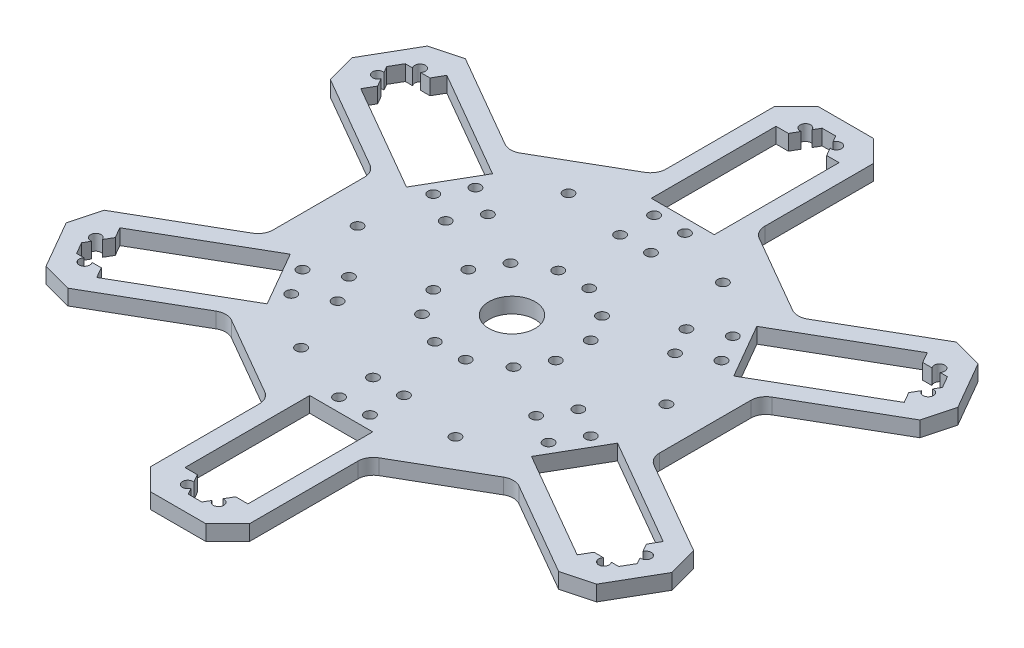
from build123d import *

# Parameters (mm, degrees)
SKETCH_1_R      = 1.7
SKETCH_1_R_2    = 7.5
EXTRUDE_1_DEPTH = 5


with BuildPart() as part:
    # 草图1 → 凸台-拉伸1 (new body)
    with BuildSketch(Plane(origin=(0, 0, 0), x_dir=(1, 0, 0), z_dir=(0, 1, 0))):
        with BuildLine():
            Line((1497.279681371, 1171.189146209), (1471.720080933, 1185.945988402))
            ThreePointArc((1471.720080933, 1185.945988402), (1469.220080933, 1186.615861383), (1466.720080933, 1185.945988402))
            Line((1466.720080933, 1185.945988402), (1436.311115589, 1168.389364075))
            Line((1436.311115589, 1168.389364075), (1426.651857326, 1170.977554526))
            Line((1426.651857326, 1170.977554526), (1417.722925138, 1186.442918733))
            Line((1417.722925138, 1186.442918733), (1420.311115589, 1196.102176996))
            Line((1420.311115589, 1196.102176996), (1450.720080933, 1213.658801323))
            ThreePointArc((1450.720080933, 1213.658801323), (1452.550207951, 1215.488928342), (1453.220080933, 1217.988928342))
            Line((1453.220080933, 1217.988928342), (1453.220080933, 1247.502612729))
            ThreePointArc((1453.220080933, 1247.502612729), (1452.550207951, 1250.002612729), (1450.720080933, 1251.832739748))
            Line((1450.720080933, 1251.832739748), (1420.311115589, 1269.389364075))
            Line((1420.311115589, 1269.389364075), (1417.722925138, 1279.048622338))
            Line((1417.722925138, 1279.048622338), (1426.651857326, 1294.513986545))
            Line((1426.651857326, 1294.513986545), (1436.311115589, 1297.102176996))
            Line((1436.311115589, 1297.102176996), (1466.720080933, 1279.545552669))
            ThreePointArc((1466.720080933, 1279.545552669), (1469.220080933, 1278.875679688), (1471.720080933, 1279.545552669))
            Line((1471.720080933, 1279.545552669), (1497.279681371, 1294.302394863))
            ThreePointArc((1497.279681371, 1294.302394863), (1499.10980839, 1296.132521882), (1499.779681371, 1298.632521882))
            Line((1499.779681371, 1298.632521882), (1499.779681371, 1333.745770536))
            Line((1499.779681371, 1333.745770536), (1506.850749183, 1340.816838348))
            Line((1506.850749183, 1340.816838348), (1524.708613559, 1340.816838348))
            Line((1524.708613559, 1340.816838348), (1531.779681371, 1333.745770536))
            Line((1531.779681371, 1333.745770536), (1531.779681371, 1298.632521882))
            ThreePointArc((1531.779681371, 1298.632521882), (1532.449554352, 1296.132521882), (1534.279681371, 1294.302394863))
            Line((1534.279681371, 1294.302394863), (1559.839281809, 1279.545552669))
            ThreePointArc((1559.839281809, 1279.545552669), (1562.339281809, 1278.875679688), (1564.839281809, 1279.545552669))
            Line((1564.839281809, 1279.545552669), (1595.248247153, 1297.102176996))
            Line((1595.248247153, 1297.102176996), (1604.907505416, 1294.513986545))
            Line((1604.907505416, 1294.513986545), (1613.836437604, 1279.048622338))
            Line((1613.836437604, 1279.048622338), (1611.248247153, 1269.389364075))
            Line((1611.248247153, 1269.389364075), (1580.839281809, 1251.832739748))
            ThreePointArc((1580.839281809, 1251.832739748), (1579.00915479, 1250.002612729), (1578.339281809, 1247.502612729))
            Line((1578.339281809, 1247.502612729), (1578.339281809, 1217.988928342))
            ThreePointArc((1578.339281809, 1217.988928342), (1579.00915479, 1215.488928342), (1580.839281809, 1213.658801323))
            Line((1580.839281809, 1213.658801323), (1611.248247153, 1196.102176996))
            Line((1611.248247153, 1196.102176996), (1613.836437604, 1186.442918733))
            Line((1613.836437604, 1186.442918733), (1604.907505416, 1170.977554526))
            Line((1604.907505416, 1170.977554526), (1595.248247153, 1168.389364075))
            Line((1595.248247153, 1168.389364075), (1564.839281809, 1185.945988402))
            ThreePointArc((1564.839281809, 1185.945988402), (1562.339281809, 1186.615861383), (1559.839281809, 1185.945988402))
            Line((1559.839281809, 1185.945988402), (1534.279681371, 1171.189146209))
            ThreePointArc((1534.279681371, 1171.189146209), (1532.449554352, 1169.35901919), (1531.779681371, 1166.85901919))
            Line((1531.779681371, 1166.85901919), (1531.779681371, 1131.745770536))
            Line((1531.779681371, 1131.745770536), (1524.708613559, 1124.674702724))
            Line((1524.708613559, 1124.674702724), (1506.850749183, 1124.674702724))
            Line((1506.850749183, 1124.674702724), (1499.779681371, 1131.745770536))
            Line((1499.779681371, 1131.745770536), (1499.779681371, 1166.85901919))
            ThreePointArc((1499.779681371, 1166.85901919), (1499.10980839, 1169.35901919), (1497.279681371, 1171.189146209))
        make_face()
        with Locations(Location((1474.112385778, 1262.575897555, 0), (0, 0, 270))):
            Circle(SKETCH_1_R, mode=Mode.SUBTRACT)
        with Locations(Location((1469.112385778, 1253.915643517, 0), (0, 0, 270))):
            Circle(SKETCH_1_R, mode=Mode.SUBTRACT)
        with Locations(Location((1483.63866522, 1257.075897555, 0), (0, 0, 270))):
            Circle(SKETCH_1_R, mode=Mode.SUBTRACT)
        with Locations(Location((1478.63866522, 1248.415643517, 0), (0, 0, 270))):
            Circle(SKETCH_1_R, mode=Mode.SUBTRACT)
        with Locations(Location((1500.959173295, 1247.075897555, 0), (0, 0, 270))):
            Circle(SKETCH_1_R, mode=Mode.SUBTRACT)
        with Locations(Location((1495.959173295, 1238.415643517, 0), (0, 0, 270))):
            Circle(SKETCH_1_R, mode=Mode.SUBTRACT)
        with Locations(Location((1465.779681371, 1232.745770536, 0), (0, 0, 270))):
            Circle(SKETCH_1_R, mode=Mode.SUBTRACT)
        with Locations(Location((1469.112385778, 1211.575897555, 0), (0, 0, 270))):
            Circle(SKETCH_1_R, mode=Mode.SUBTRACT)
        with Locations(Location((1474.112385778, 1202.915643517, 0), (0, 0, 270))):
            Circle(SKETCH_1_R, mode=Mode.SUBTRACT)
        with Locations(Location((1478.63866522, 1217.075897555, 0), (0, 0, 270))):
            Circle(SKETCH_1_R, mode=Mode.SUBTRACT)
        with Locations(Location((1483.63866522, 1208.415643517, 0), (0, 0, 270))):
            Circle(SKETCH_1_R, mode=Mode.SUBTRACT)
        with Locations(Location((1495.959173295, 1227.075897555, 0), (0, 0, 270))):
            Circle(SKETCH_1_R, mode=Mode.SUBTRACT)
        with Locations(Location((1500.959173295, 1218.415643517, 0), (0, 0, 270))):
            Circle(SKETCH_1_R, mode=Mode.SUBTRACT)
        with Locations(Location((1490.779681371, 1189.444500346, 0), (0, 0, 270))):
            Circle(SKETCH_1_R, mode=Mode.SUBTRACT)
        with Locations(Location((1510.779681371, 1181.745770536, 0), (0, 0, 270))):
            Circle(SKETCH_1_R, mode=Mode.SUBTRACT)
        with Locations(Location((1520.779681371, 1181.745770536, 0), (0, 0, 270))):
            Circle(SKETCH_1_R, mode=Mode.SUBTRACT)
        with Locations(Location((1510.779681371, 1192.745770536, 0), (0, 0, 270))):
            Circle(SKETCH_1_R, mode=Mode.SUBTRACT)
        with Locations(Location((1520.779681371, 1192.745770536, 0), (0, 0, 270))):
            Circle(SKETCH_1_R, mode=Mode.SUBTRACT)
        with Locations(Location((1510.779681371, 1212.745770536, 0), (0, 0, 270))):
            Circle(SKETCH_1_R, mode=Mode.SUBTRACT)
        with Locations(Location((1520.779681371, 1212.745770536, 0), (0, 0, 270))):
            Circle(SKETCH_1_R, mode=Mode.SUBTRACT)
        with Locations(Location((1540.779681371, 1189.444500346, 0), (0, 0, 270))):
            Circle(SKETCH_1_R, mode=Mode.SUBTRACT)
        with Locations(Location((1557.446976964, 1202.915643517, 0), (0, 0, 270))):
            Circle(SKETCH_1_R, mode=Mode.SUBTRACT)
        with Locations(Location((1562.446976964, 1211.575897555, 0), (0, 0, 270))):
            Circle(SKETCH_1_R, mode=Mode.SUBTRACT)
        with Locations(Location((1547.920697522, 1208.415643517, 0), (0, 0, 270))):
            Circle(SKETCH_1_R, mode=Mode.SUBTRACT)
        with Locations(Location((1552.920697522, 1217.075897555, 0), (0, 0, 270))):
            Circle(SKETCH_1_R, mode=Mode.SUBTRACT)
        with Locations(Location((1530.600189447, 1218.415643517, 0), (0, 0, 270))):
            Circle(SKETCH_1_R, mode=Mode.SUBTRACT)
        with Locations(Location((1535.600189447, 1227.075897555, 0), (0, 0, 270))):
            Circle(SKETCH_1_R, mode=Mode.SUBTRACT)
        with Locations(Location((1565.779681371, 1232.745770536, 0), (0, 0, 270))):
            Circle(SKETCH_1_R, mode=Mode.SUBTRACT)
        with Locations(Location((1562.446976964, 1253.915643517, 0), (0, 0, 270))):
            Circle(SKETCH_1_R, mode=Mode.SUBTRACT)
        with Locations(Location((1557.446976964, 1262.575897555, 0), (0, 0, 270))):
            Circle(SKETCH_1_R, mode=Mode.SUBTRACT)
        with Locations(Location((1552.920697522, 1248.415643517, 0), (0, 0, 270))):
            Circle(SKETCH_1_R, mode=Mode.SUBTRACT)
        with Locations(Location((1547.920697522, 1257.075897555, 0), (0, 0, 270))):
            Circle(SKETCH_1_R, mode=Mode.SUBTRACT)
        with Locations(Location((1535.600189447, 1238.415643517, 0), (0, 0, 270))):
            Circle(SKETCH_1_R, mode=Mode.SUBTRACT)
        with Locations(Location((1530.600189447, 1247.075897555, 0), (0, 0, 270))):
            Circle(SKETCH_1_R, mode=Mode.SUBTRACT)
        with Locations(Location((1540.779681371, 1276.047040725, 0), (0, 0, 270))):
            Circle(SKETCH_1_R, mode=Mode.SUBTRACT)
        with Locations(Location((1520.779681371, 1283.745770536, 0), (0, 0, 270))):
            Circle(SKETCH_1_R, mode=Mode.SUBTRACT)
        with Locations(Location((1510.779681371, 1283.745770536, 0), (0, 0, 270))):
            Circle(SKETCH_1_R, mode=Mode.SUBTRACT)
        with Locations(Location((1520.779681371, 1272.745770536, 0), (0, 0, 270))):
            Circle(SKETCH_1_R, mode=Mode.SUBTRACT)
        with Locations(Location((1510.779681371, 1272.745770536, 0), (0, 0, 270))):
            Circle(SKETCH_1_R, mode=Mode.SUBTRACT)
        with Locations(Location((1520.779681371, 1252.745770536, 0), (0, 0, 270))):
            Circle(SKETCH_1_R, mode=Mode.SUBTRACT)
        with Locations(Location((1510.779681371, 1252.745770536, 0), (0, 0, 270))):
            Circle(SKETCH_1_R, mode=Mode.SUBTRACT)
        with Locations(Location((1490.779681371, 1276.047040725, 0), (0, 0, 270))):
            Circle(SKETCH_1_R, mode=Mode.SUBTRACT)
        with Locations(Location((1515.779681371, 1232.745770536, 0), (0, 0, 270))):
            Circle(SKETCH_1_R_2, mode=Mode.SUBTRACT)
        with BuildLine():
            Line((1438.001050229, 1289.429229654), (1472.988476542, 1269.229229654))
            Line((1472.988476542, 1269.229229654), (1462.788476542, 1251.562311417))
            Line((1462.788476542, 1251.562311417), (1427.801050229, 1271.762311417))
            Line((1427.801050229, 1271.762311417), (1429.801050229, 1275.226413032))
            Line((1429.801050229, 1275.226413032), (1428.282561049, 1277.856513442))
            ThreePointArc((1428.282561049, 1277.856513442), (1425.204897806, 1277.565643517), (1426.995630172, 1280.085543107))
            Line((1426.995630172, 1280.085543107), (1425.801050229, 1282.154616263))
            Line((1425.801050229, 1282.154616263), (1428.001050229, 1285.965128039))
            Line((1428.001050229, 1285.965128039), (1430.390210115, 1285.965128039))
            ThreePointArc((1430.390210115, 1285.965128039), (1431.677140992, 1288.775897555), (1432.96407187, 1285.965128039))
            Line((1432.96407187, 1285.965128039), (1436.001050229, 1285.965128039))
            Line((1436.001050229, 1285.965128039), (1438.001050229, 1289.429229654))
        make_face(mode=Mode.SUBTRACT)
        with BuildLine():
            Line((1427.801050229, 1193.729229654), (1462.788476542, 1213.929229654))
            Line((1462.788476542, 1213.929229654), (1472.988476542, 1196.262311417))
            Line((1472.988476542, 1196.262311417), (1438.001050229, 1176.062311417))
            Line((1438.001050229, 1176.062311417), (1436.001050229, 1179.526413032))
            Line((1436.001050229, 1179.526413032), (1432.96407187, 1179.526413032))
            ThreePointArc((1432.96407187, 1179.526413032), (1431.677140992, 1176.715643517), (1430.390210115, 1179.526413032))
            Line((1430.390210115, 1179.526413032), (1428.001050229, 1179.526413032))
            Line((1428.001050229, 1179.526413032), (1425.801050229, 1183.336924809))
            Line((1425.801050229, 1183.336924809), (1426.995630172, 1185.405997964))
            ThreePointArc((1426.995630172, 1185.405997964), (1425.204897806, 1187.925897555), (1428.282561049, 1187.63502763))
            Line((1428.282561049, 1187.63502763), (1429.801050229, 1190.265128039))
            Line((1429.801050229, 1190.265128039), (1427.801050229, 1193.729229654))
        make_face(mode=Mode.SUBTRACT)
        with BuildLine():
            Line((1505.579681371, 1137.045770536), (1505.579681371, 1177.445770536))
            Line((1505.579681371, 1177.445770536), (1525.979681371, 1177.445770536))
            Line((1525.979681371, 1177.445770536), (1525.979681371, 1137.045770536))
            Line((1525.979681371, 1137.045770536), (1521.979681371, 1137.045770536))
            Line((1521.979681371, 1137.045770536), (1520.461192192, 1134.415670126))
            ThreePointArc((1520.461192192, 1134.415670126), (1522.251924557, 1131.895770536), (1519.174261314, 1132.186640461))
            Line((1519.174261314, 1132.186640461), (1517.979681371, 1130.117567305))
            Line((1517.979681371, 1130.117567305), (1513.579681371, 1130.117567305))
            Line((1513.579681371, 1130.117567305), (1512.385101428, 1132.186640461))
            ThreePointArc((1512.385101428, 1132.186640461), (1509.307438185, 1131.895770536), (1511.09817055, 1134.415670126))
            Line((1511.09817055, 1134.415670126), (1509.579681371, 1137.045770536))
            Line((1509.579681371, 1137.045770536), (1505.579681371, 1137.045770536))
        make_face(mode=Mode.SUBTRACT)
        with BuildLine():
            Line((1593.558312513, 1176.062311417), (1558.5708862, 1196.262311417))
            Line((1558.5708862, 1196.262311417), (1568.7708862, 1213.929229654))
            Line((1568.7708862, 1213.929229654), (1603.758312513, 1193.729229654))
            Line((1603.758312513, 1193.729229654), (1601.758312513, 1190.265128039))
            Line((1601.758312513, 1190.265128039), (1603.276801692, 1187.63502763))
            ThreePointArc((1603.276801692, 1187.63502763), (1606.354464936, 1187.925897555), (1604.56373257, 1185.405997964))
            Line((1604.56373257, 1185.405997964), (1605.758312513, 1183.336924809))
            Line((1605.758312513, 1183.336924809), (1603.558312513, 1179.526413032))
            Line((1603.558312513, 1179.526413032), (1601.169152627, 1179.526413032))
            ThreePointArc((1601.169152627, 1179.526413032), (1599.882221749, 1176.715643517), (1598.595290872, 1179.526413032))
            Line((1598.595290872, 1179.526413032), (1595.558312513, 1179.526413032))
            Line((1595.558312513, 1179.526413032), (1593.558312513, 1176.062311417))
        make_face(mode=Mode.SUBTRACT)
        with BuildLine():
            Line((1603.758312513, 1271.762311417), (1568.7708862, 1251.562311417))
            Line((1568.7708862, 1251.562311417), (1558.5708862, 1269.229229654))
            Line((1558.5708862, 1269.229229654), (1593.558312513, 1289.429229654))
            Line((1593.558312513, 1289.429229654), (1595.558312513, 1285.965128039))
            Line((1595.558312513, 1285.965128039), (1598.595290872, 1285.965128039))
            ThreePointArc((1598.595290872, 1285.965128039), (1599.882221749, 1288.775897555), (1601.169152627, 1285.965128039))
            Line((1601.169152627, 1285.965128039), (1603.558312513, 1285.965128039))
            Line((1603.558312513, 1285.965128039), (1605.758312513, 1282.154616263))
            Line((1605.758312513, 1282.154616263), (1604.56373257, 1280.085543107))
            ThreePointArc((1604.56373257, 1280.085543107), (1606.354464936, 1277.565643517), (1603.276801692, 1277.856513442))
            Line((1603.276801692, 1277.856513442), (1601.758312513, 1275.226413032))
            Line((1601.758312513, 1275.226413032), (1603.758312513, 1271.762311417))
        make_face(mode=Mode.SUBTRACT)
        with BuildLine():
            Line((1525.979681371, 1288.045770536), (1505.579681371, 1288.045770536))
            Line((1505.579681371, 1288.045770536), (1505.579681371, 1328.445770536))
            Line((1505.579681371, 1328.445770536), (1509.579681371, 1328.445770536))
            Line((1509.579681371, 1328.445770536), (1511.09817055, 1331.075870945))
            ThreePointArc((1511.09817055, 1331.075870945), (1509.307438185, 1333.595770536), (1512.385101428, 1333.304900611))
            Line((1512.385101428, 1333.304900611), (1513.579681371, 1335.373973766))
            Line((1513.579681371, 1335.373973766), (1517.979681371, 1335.373973766))
            Line((1517.979681371, 1335.373973766), (1519.174261314, 1333.304900611))
            ThreePointArc((1519.174261314, 1333.304900611), (1522.251924557, 1333.595770536), (1520.461192192, 1331.075870945))
            Line((1520.461192192, 1331.075870945), (1521.979681371, 1328.445770536))
            Line((1521.979681371, 1328.445770536), (1525.979681371, 1328.445770536))
            Line((1525.979681371, 1328.445770536), (1525.979681371, 1288.045770536))
        make_face(mode=Mode.SUBTRACT)
    extrude(amount=EXTRUDE_1_DEPTH)


solid = part.part
